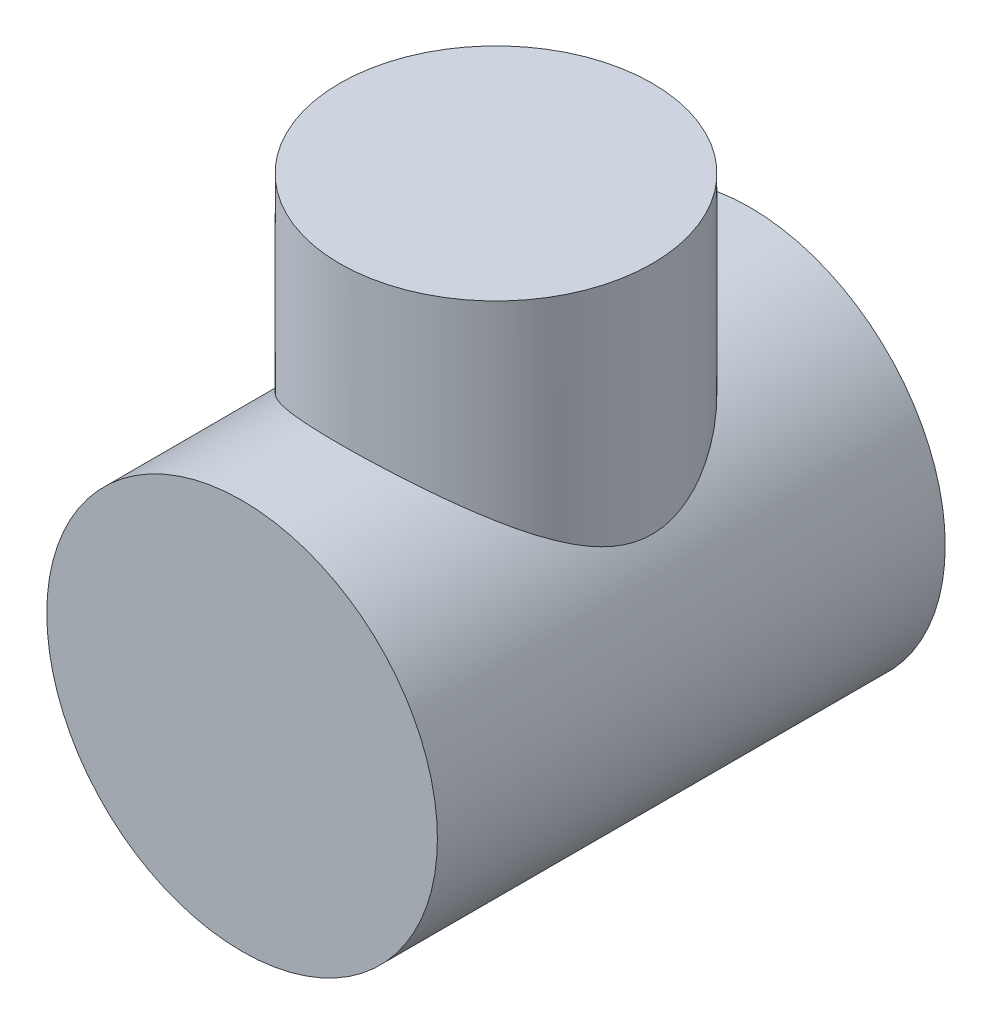
from build123d import *

# Parameters (mm, degrees)
SKETCH1_R           = 2
BOSS_EXTRUDE1_DEPTH = 4.5
SKETCH3_R           = 2.5
BOSS_EXTRUDE2_DEPTH = 3.25


with BuildPart() as part:
    # Sketch1 → Boss-Extrude1 (new body)
    with BuildSketch(Plane(origin=(0, 0, 0), x_dir=(1, 0, 0), z_dir=(0, 1, 0))):
        with Locations(Location((0, 0, 0), (0, 0, 270))):
            Circle(SKETCH1_R)
    extrude(amount=BOSS_EXTRUDE1_DEPTH)

    # Sketch3 → Boss-Extrude2 (add, symmetric)
    with BuildSketch(Plane.XY):
        Circle(SKETCH3_R)
    extrude(amount=BOSS_EXTRUDE2_DEPTH, both=True)


solid = part.part
